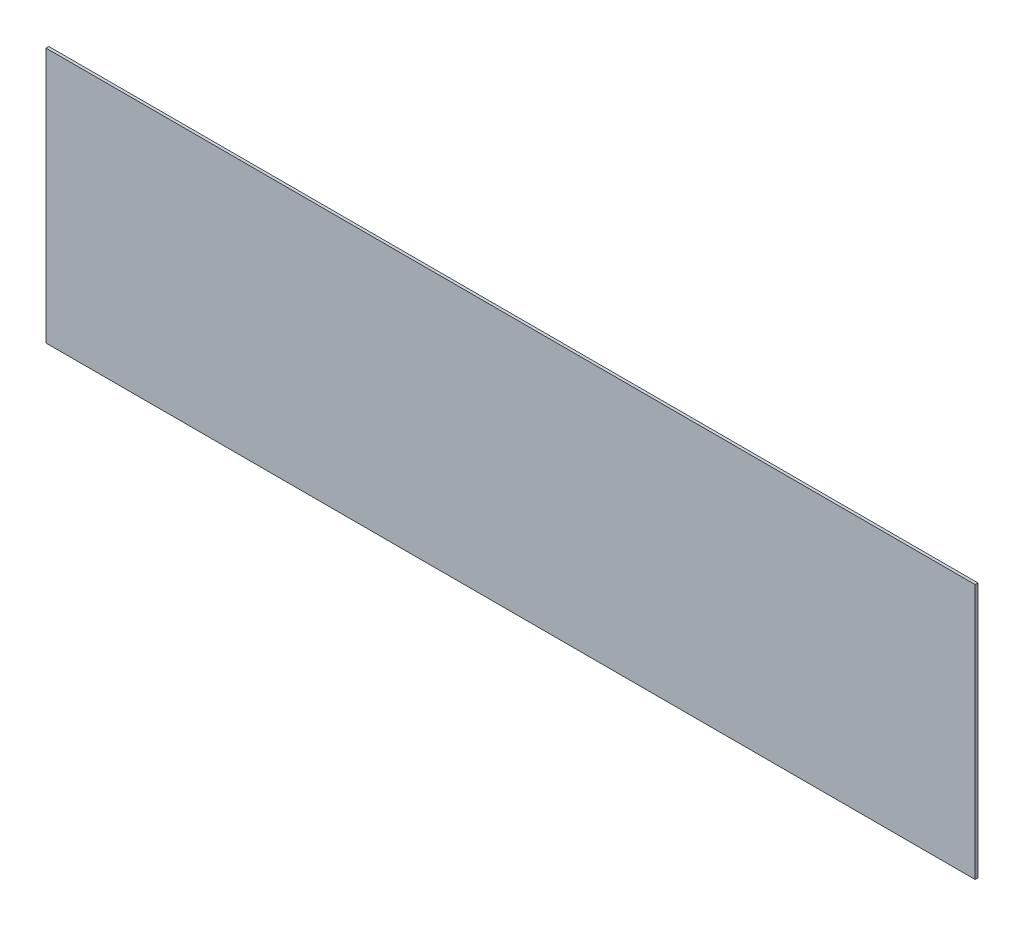
from build123d import *

# Parameters (mm, degrees)
SKETCH_1_W      = 165.5
SKETCH_1_H      = 45.5
EXTRUDE_1_DEPTH = 0.5


with BuildPart() as part:
    # 草图1 → 凸台-拉伸1 (new body)
    with BuildSketch(Plane.XY):
        with Locations((-30.753324334, -11.184405172)):
            Rectangle(SKETCH_1_W, SKETCH_1_H)
    extrude(amount=EXTRUDE_1_DEPTH)


solid = part.part
